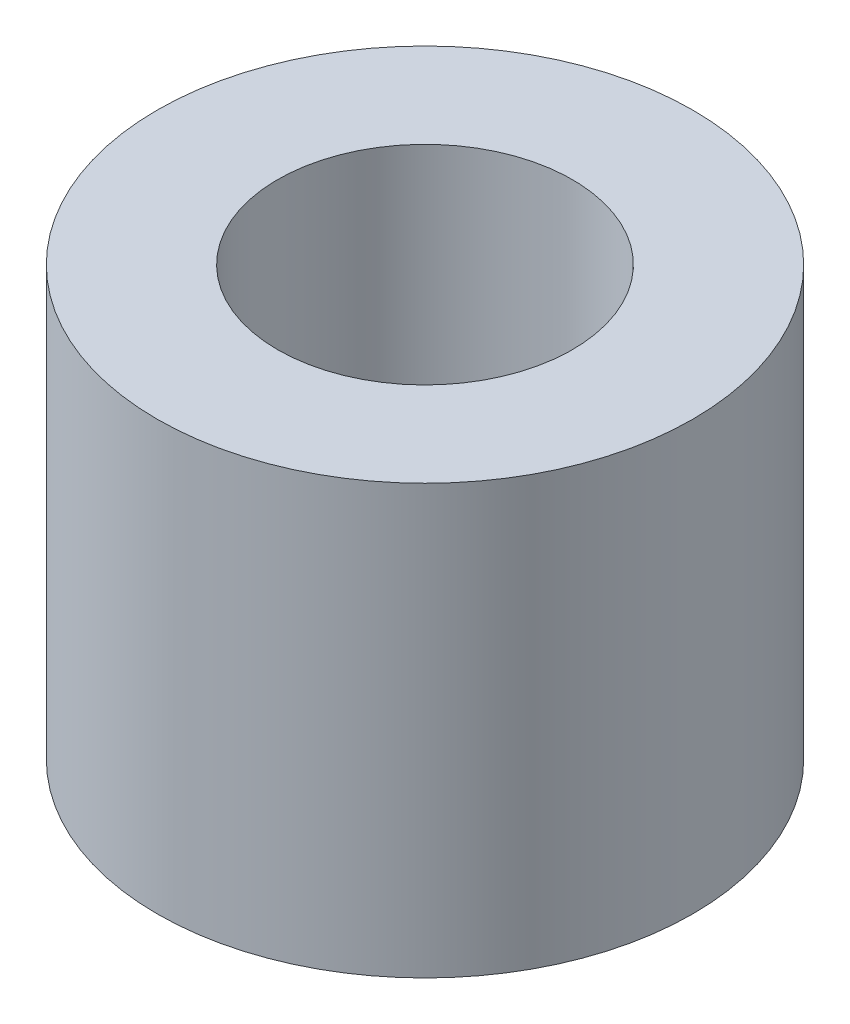
from build123d import *

# Parameters (mm, degrees)
SKETCH1_R           = 7.9375
SKETCH1_R_2         = 4.3688
BOSS_EXTRUDE1_DEPTH = 12.7


with BuildPart() as part:
    # Sketch1 → Boss-Extrude1 (new body)
    with BuildSketch(Plane(origin=(0, 0, 0), x_dir=(1, 0, 0), z_dir=(0, 1, 0))):
        with Locations(Location((0, 0, 0), (0, 0, 270))):
            Circle(SKETCH1_R)
        with Locations(Location((0, 0, 0), (0, 0, 270))):
            Circle(SKETCH1_R_2, mode=Mode.SUBTRACT)
    extrude(amount=BOSS_EXTRUDE1_DEPTH)


solid = part.part
